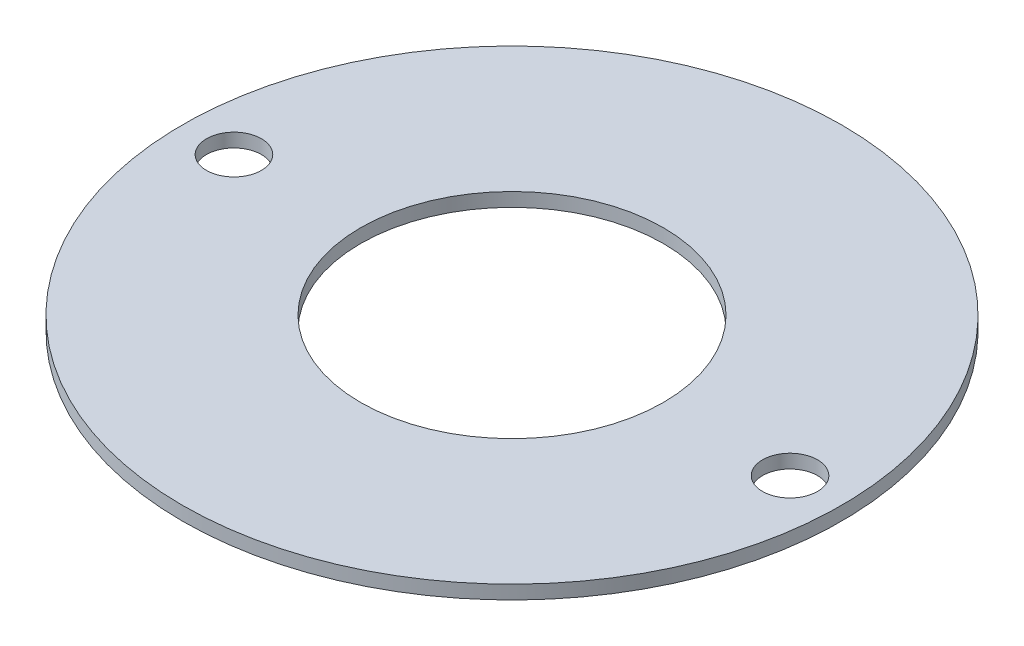
from build123d import *

# Parameters (mm, degrees)
SKETCH1_R           = 76.2
BOSS_EXTRUDE1_DEPTH = 3.175
SKETCH2_R           = 35
CUT_EXTRUDE1_DEPTH  = 3.175
SKETCH3_R           = 6.35
CUT_EXTRUDE2_DEPTH  = 10


with BuildPart() as part:
    # Sketch1 → Boss-Extrude1 (new body)
    with BuildSketch(Plane(origin=(0, 0, 0), x_dir=(1, 0, 0), z_dir=(0, 1, 0))):
        with Locations(Location((0, 0, 0), (0, 0, 270))):
            Circle(SKETCH1_R)
    extrude(amount=BOSS_EXTRUDE1_DEPTH)

    # Sketch2 → Cut-Extrude1 (cut)
    with BuildSketch(Plane(origin=(0, 3.175, 0), x_dir=(1, 0, 0), z_dir=(0, 1, 0))):
        with Locations(Location((0, 0, 0), (0, 0, 270))):
            Circle(SKETCH2_R)
    extrude(amount=-CUT_EXTRUDE1_DEPTH, mode=Mode.SUBTRACT)

    # Sketch3 → Cut-Extrude2 (cut)
    with BuildSketch(Plane(origin=(0, 3.175, 0), x_dir=(1, 0, 0), z_dir=(0, 1, 0))):
        with Locations(Location((-64.2875, 0, 0), (0, 0, 270))):
            Circle(SKETCH3_R)
        with Locations(Location((64.2875, 0, 0), (0, 0, 270))):
            Circle(SKETCH3_R)
    extrude(amount=-CUT_EXTRUDE2_DEPTH, mode=Mode.SUBTRACT)


solid = part.part
